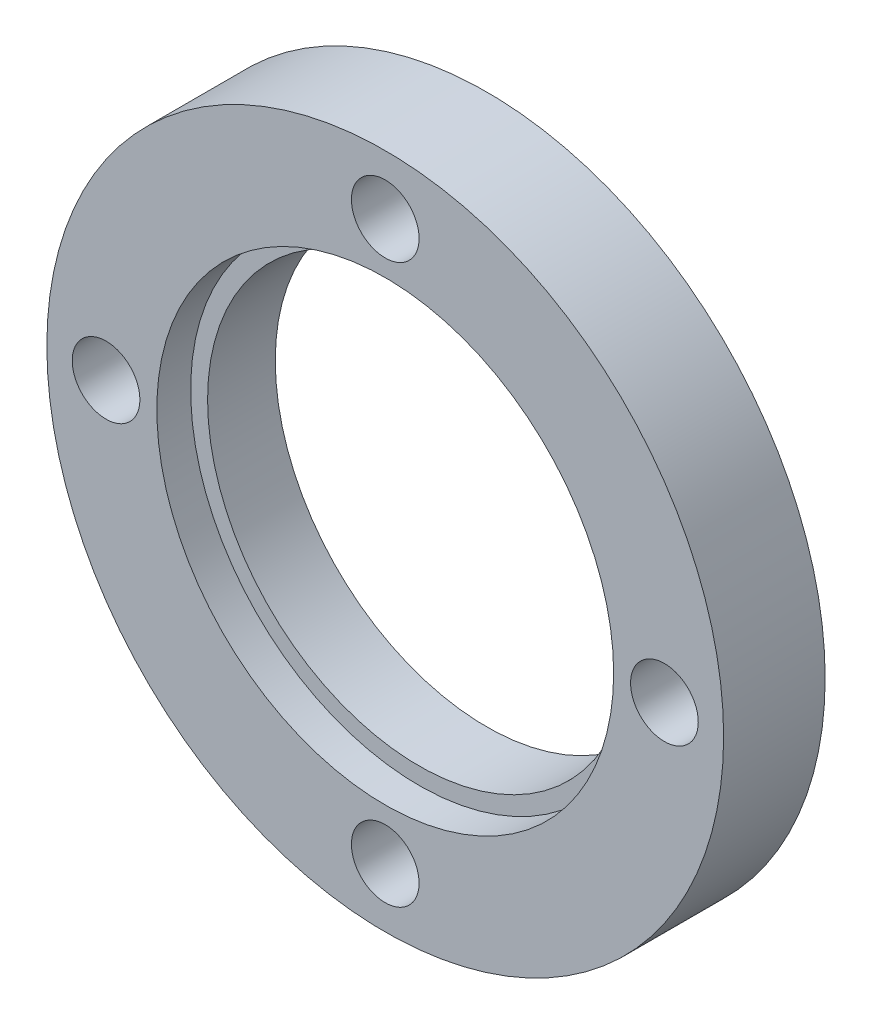
from build123d import *

# Parameters (mm, degrees)
SKETCH1_R           = 40
BOSS_EXTRUDE1_DEPTH = 12
SKETCH2_R           = 25
CUT_EXTRUDE1_DEPTH  = 58.827329179
SKETCH3_R           = 4
CUT_EXTRUDE2_DEPTH  = 58.827329179
CUT_EXTRUDE3_START  = -4
SKETCH4_R           = 27
SKETCH4_R_2         = 25
CUT_EXTRUDE3_DEPTH  = 4


with BuildPart() as part:
    # Sketch1 → Boss-Extrude1 (new body)
    with BuildSketch(Plane.XY):
        Circle(SKETCH1_R)
    extrude(amount=BOSS_EXTRUDE1_DEPTH)

    # Sketch2 → Cut-Extrude1 (cut, through all)
    with BuildSketch(Plane(origin=(0, 0, 0), x_dir=(-1, 0, 0), z_dir=(0, 0, -1))):
        Circle(SKETCH2_R)
    extrude(amount=-CUT_EXTRUDE1_DEPTH, mode=Mode.SUBTRACT)

    # Sketch3 → Cut-Extrude2 (cut, through all)
    with BuildSketch(Plane.XY.offset(12)):
        with Locations((-33, 0)):
            Circle(SKETCH3_R)
        with Locations((0, 33)):
            Circle(SKETCH3_R)
        with Locations((33, 0)):
            Circle(SKETCH3_R)
        with Locations((0, -33)):
            Circle(SKETCH3_R)
    extrude(amount=-CUT_EXTRUDE2_DEPTH, mode=Mode.SUBTRACT)

    # Sketch4 → Cut-Extrude3 (cut)
    with BuildSketch(Plane.XY.offset(12).offset(CUT_EXTRUDE3_START)):
        Circle(SKETCH4_R)
        with Locations(Location((0, 0, 0), (0, 0, 180))):
            Circle(SKETCH4_R_2, mode=Mode.SUBTRACT)
    extrude(amount=CUT_EXTRUDE3_DEPTH, mode=Mode.SUBTRACT)


solid = part.part
